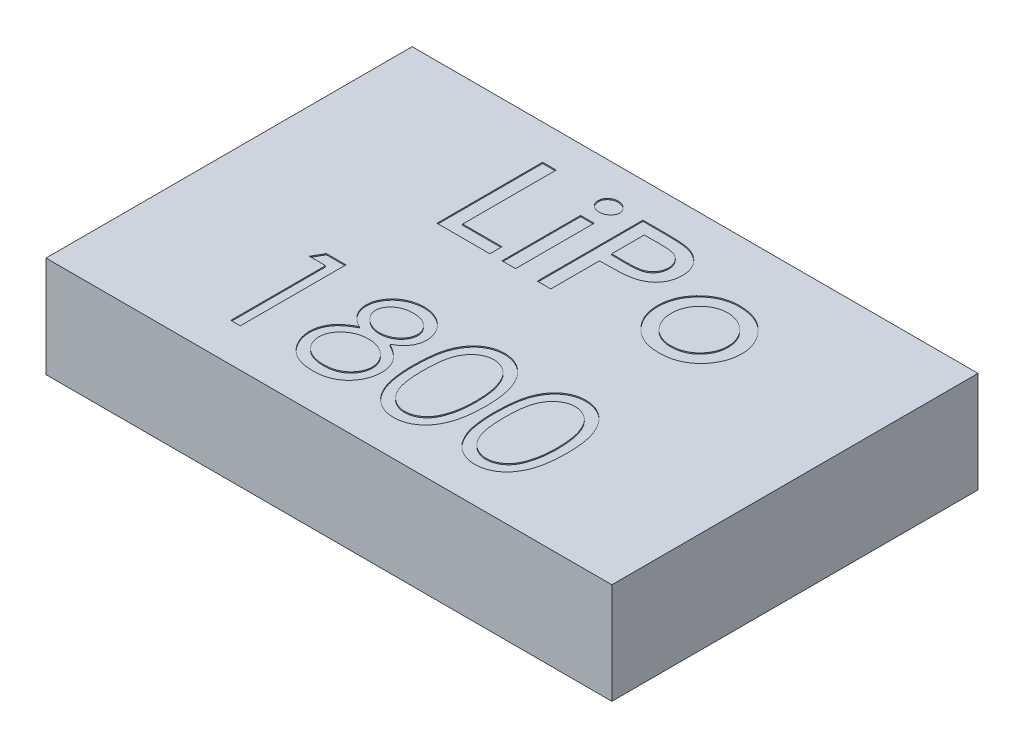
from build123d import *

# Parameters (mm, degrees)
SKETCH1_W           = 51
SKETCH1_H           = 33
BOSS_EXTRUDE1_DEPTH = 9.1
SKETCH2_W           = 1.221153846
SKETCH2_H           = 7.082692307
CUT_EXTRUDE1_DEPTH  = 0.1


with BuildPart() as part:
    # Sketch1 → Boss-Extrude1 (new body)
    with BuildSketch(Plane(origin=(0, 0, 0), x_dir=(1, 0, 0), z_dir=(0, 1, 0))):
        Rectangle(SKETCH1_W, SKETCH1_H)
    extrude(amount=BOSS_EXTRUDE1_DEPTH)

    # Sketch2 → Cut-Extrude1 (cut)
    # profile 1 of 9: a face of its own
    with BuildSketch(Plane(origin=(0, 9.1, 0), x_dir=(1, 0, 0), z_dir=(0, 1, 0))):
        Polygon((-10.598350213, 13.361806238), (-9.377196366, 13.361806238), (-9.377196366, 4.935844699), (-5.835850213, 4.935844699), (-5.835850213, 3.836806238), (-10.598350213, 3.836806238), align=None)
    # profile 2 of 9: a face of its own
    with BuildSketch(Plane(origin=(0, 9.1, 0), x_dir=(1, 0, 0), z_dir=(0, 1, 0))):
        with BuildLine():
            add(Edge.make_bspline(
                [(-4.191108626, 13.728152391), (-4.117679851, 13.724936738), (-3.976010868, 13.718732654), (-3.774094218, 13.66883684), (-3.593608765, 13.583028953), (-3.439854764, 13.464806694), (-3.312430853, 13.329393442), (-3.218088844, 13.183124591), (-3.161358797, 13.028050952), (-3.153307957, 12.922113108), (-3.149311751, 12.869528593)],
                knots=[0, 0, 0, 0, 1.180073081, 2.27676073, 3.320042968, 4.371717959, 5.377874923, 6.297457691, 7.154906711, 8, 8, 8, 8], degree=3))
            add(Edge.make_bspline(
                [(-3.149311751, 12.869528593), (-3.153315742, 12.817580851), (-3.161385463, 12.712884367), (-3.218078584, 12.559593325), (-3.313147329, 12.415284565), (-3.439179305, 12.279755579), (-3.594298376, 12.163936181), (-3.773997961, 12.07772869), (-3.976037617, 12.027991166), (-4.117688982, 12.021764411), (-4.191108626, 12.018537007)],
                knots=[0, 0, 0, 0, 0.838561902, 1.690053866, 2.604955955, 3.615478493, 4.665551833, 5.713360726, 6.814806749, 8, 8, 8, 8], degree=3))
            add(Edge.make_bspline(
                [(-4.191108626, 12.018537007), (-4.251925389, 12.021005876), (-4.370486997, 12.025818909), (-4.539982929, 12.077350709), (-4.697879131, 12.153451605), (-4.837234525, 12.262703327), (-4.954854465, 12.391748931), (-5.042220572, 12.538620751), (-5.093137316, 12.70024352), (-5.099786593, 12.812574569), (-5.103157905, 12.869528593)],
                knots=[0, 0, 0, 0, 1.050897616, 2.04871332, 3.044517726, 4.074156936, 5.096691018, 6.055190702, 7.01394389, 8, 8, 8, 8], degree=3))
            add(Edge.make_bspline(
                [(-5.103157905, 12.869528593), (-5.099927283, 12.927785626), (-5.093623853, 13.041453883), (-5.041722256, 13.204602794), (-4.955499043, 13.352748346), (-4.837236543, 13.482202432), (-4.697366444, 13.590885636), (-4.540011108, 13.670210698), (-4.369678147, 13.720298104), (-4.251238919, 13.725507592), (-4.191108626, 13.728152391)],
                knots=[0, 0, 0, 0, 1.003476519, 1.957934027, 2.921620235, 3.939572868, 4.964598795, 5.960849032, 6.964745478, 8, 8, 8, 8], degree=3))
        make_face()
    # profile 3 of 9: a face of its own
    with BuildSketch(Plane(origin=(0, 9.1, 0), x_dir=(1, 0, 0), z_dir=(0, 1, 0))):
        with Locations((-4.126234828, 7.378152392)):
            Rectangle(SKETCH2_W, SKETCH2_H)
    # profile 4 of 9: a face of its own
    with BuildSketch(Plane(origin=(0, 9.1, 0), x_dir=(1, 0, 0), z_dir=(0, 1, 0))):
        with BuildLine():
            Line((-1.561811751, 13.361806238), (0.39012635, 13.361806238))
            add(Edge.make_bspline(
                [(0.39012635, 13.361806238), (0.519245437, 13.361735896), (0.766696602, 13.361601089), (1.121568036, 13.352466126), (1.443516336, 13.344581896), (1.7330172, 13.329427732), (1.989411503, 13.308669432), (2.212791287, 13.284260159), (2.403396397, 13.256806468), (2.518346216, 13.231986144), (2.571030797, 13.220610324)],
                knots=[0, 0, 0, 0, 1.415450773, 2.712650385, 3.891531898, 4.945867971, 5.890285756, 6.71109784, 7.409261617, 8, 8, 8, 8], degree=3))
            add(Edge.make_bspline(
                [(2.571030797, 13.220610324), (2.645196833, 13.201538109), (2.79150369, 13.163914474), (3.000654784, 13.086361035), (3.199110919, 12.998237538), (3.386194529, 12.897994081), (3.559994629, 12.782218262), (3.724260868, 12.656429647), (3.873940665, 12.514266027), (4.014161925, 12.362624074), (4.137192867, 12.198040163), (4.247428946, 12.026083319), (4.33879789, 11.844255917), (4.413887702, 11.653234293), (4.472588124, 11.454014393), (4.514812185, 11.245961473), (4.540184167, 11.029531762), (4.54268417, 10.882042909), (4.54395748, 10.806923425)],
                knots=[0, 0, 0, 0, 1.085641105, 2.141637125, 3.15936318, 4.164535163, 5.147931294, 6.118832473, 7.09541784, 8.072503165, 9.045079613, 10.006206652, 10.966486436, 11.926469503, 12.914201526, 13.908586125, 14.934794539, 16, 16, 16, 16], degree=3))
            add(Edge.make_bspline(
                [(4.54395748, 10.806923425), (4.542656234, 10.731807441), (4.540090433, 10.583693382), (4.51487867, 10.365969824), (4.472616345, 10.1574847), (4.415638852, 9.95731699), (4.340757786, 9.766711569), (4.251281111, 9.58405928), (4.14312097, 9.41142953), (4.019643415, 9.247624084), (3.88020202, 9.095160283), (3.726817677, 8.954616816), (3.557474197, 8.82844822), (3.373908393, 8.714389899), (3.176759905, 8.610441779), (2.964045399, 8.521034987), (2.7367139, 8.444851885), (2.578940711, 8.404343242), (2.498524787, 8.383696262)],
                knots=[0, 0, 0, 0, 1.042501879, 2.055610221, 3.037454288, 3.993184118, 4.940927036, 5.876790881, 6.812738028, 7.76458517, 8.720845088, 9.677105007, 10.648370915, 11.647960469, 12.67482723, 13.739162042, 14.847666245, 16, 16, 16, 16], degree=3))
            add(Edge.make_bspline(
                [(2.498524787, 8.383696262), (2.439505759, 8.370900511), (2.310756969, 8.342986846), (2.097106095, 8.313940679), (1.848159215, 8.290144344), (1.563129515, 8.269441091), (1.243185328, 8.252050173), (0.886907518, 8.241697777), (0.49510865, 8.233344161), (0.221587158, 8.233091626), (0.07911373, 8.232960084)],
                knots=[0, 0, 0, 0, 0.596754895, 1.30180848, 2.129432098, 3.068723067, 4.126429569, 5.296393252, 6.591729958, 8, 8, 8, 8], degree=3))
            Line((0.07911373, 8.232960084), (-0.340657905, 8.232960084))
            Line((-0.340657905, 8.232960084), (-0.340657905, 3.836806238))
            Line((-0.340657905, 3.836806238), (-1.561811751, 3.836806238))
            Line((-1.561811751, 3.836806238), (-1.561811751, 13.361806238))
        make_face()
        with BuildLine():
            Line((-0.340657905, 12.262767776), (-0.340657905, 9.328182439))
            Line((-0.340657905, 9.328182439), (1.033140172, 9.312918016))
            add(Edge.make_bspline(
                [(1.033140172, 9.312918016), (1.110737224, 9.313941236), (1.260242308, 9.315912659), (1.475989828, 9.32275767), (1.674431727, 9.336669694), (1.855951328, 9.352895027), (2.020915325, 9.37564302), (2.168581062, 9.404033617), (2.300207641, 9.43593199), (2.450724508, 9.486083293), (2.619204629, 9.564390582), (2.798317402, 9.683871308), (2.956199136, 9.826761452), (3.086585638, 9.994942872), (3.191515296, 10.180245704), (3.269512158, 10.378300221), (3.313659786, 10.588739575), (3.319729862, 10.732312671), (3.322803634, 10.805015372)],
                knots=[0, 0, 0, 0, 1.196816259, 2.305888068, 3.328295896, 4.264290022, 5.116006351, 5.89509982, 6.582615619, 7.202969204, 8.339503699, 9.435837163, 10.511976311, 11.608836183, 12.702577786, 13.786378287, 14.879063815, 16, 16, 16, 16], degree=3))
            add(Edge.make_bspline(
                [(3.322803634, 10.805015372), (3.319707658, 10.875180935), (3.313566908, 11.014351692), (3.269188509, 11.219036461), (3.19115565, 11.413186301), (3.086055084, 11.595886121), (2.958338151, 11.762876496), (2.807051368, 11.906529507), (2.635836608, 12.023934033), (2.475994457, 12.099129558), (2.333470587, 12.148065413), (2.207856286, 12.176811812), (2.065950506, 12.203689297), (1.906872052, 12.226730861), (1.730472926, 12.243348817), (1.536965772, 12.254008336), (1.327052093, 12.262361741), (1.181341855, 12.262628958), (1.105646182, 12.262767776)],
                knots=[0, 0, 0, 0, 1.113934591, 2.209447376, 3.306634974, 4.424089692, 5.547326231, 6.633252657, 7.723023745, 8.829884498, 9.427152571, 10.113060991, 10.873719268, 11.720735618, 12.664423995, 13.686322671, 14.798057257, 16, 16, 16, 16], degree=3))
            Line((1.105646182, 12.262767776), (-0.340657905, 12.262767776))
        make_face(mode=Mode.SUBTRACT)
    # profile 5 of 9: a face of its own
    with BuildSketch(Plane(origin=(0, 9.1, 0), x_dir=(1, 0, 0), z_dir=(0, 1, 0))):
        with BuildLine():
            add(Edge.make_bspline(
                [(9.493446662, 11.04161393), (9.634797507, 11.037743055), (9.911535782, 11.030164612), (10.316476842, 10.97684668), (10.701009508, 10.884208572), (11.066235877, 10.757416424), (11.410652857, 10.591301023), (11.735120689, 10.390330074), (12.038479309, 10.150595784), (12.221211194, 9.966773961), (12.313548826, 9.873885564)],
                knots=[0, 0, 0, 0, 1.078775739, 2.112039281, 3.110494877, 4.093081892, 5.057110616, 6.022958758, 7.000966324, 8, 8, 8, 8], degree=3))
            add(Edge.make_bspline(
                [(12.313548826, 9.873885564), (12.395433514, 9.781816715), (12.556425196, 9.600802178), (12.764443884, 9.308817138), (12.941597314, 9.008455168), (13.084919194, 8.697451839), (13.199157087, 8.377229304), (13.278381894, 8.046522259), (13.32827169, 7.705956336), (13.333579083, 7.47563716), (13.336265172, 7.359071863)],
                knots=[0, 0, 0, 0, 1.062178036, 2.088324843, 3.086640365, 4.066023852, 5.037709567, 6.014384934, 6.995073642, 8, 8, 8, 8], degree=3))
            add(Edge.make_bspline(
                [(13.336265172, 7.359071863), (13.332907951, 7.241863368), (13.326254405, 7.009572423), (13.274752139, 6.666429179), (13.193300368, 6.332425919), (13.076129763, 6.009087469), (12.925333935, 5.696062999), (12.744424903, 5.3914484), (12.526306673, 5.099298018), (12.281065406, 4.818764785), (12.008532914, 4.55996085), (11.711109613, 4.333380476), (11.392441672, 4.141633173), (11.053104502, 3.983798683), (10.691479758, 3.864533619), (10.311070578, 3.776210386), (9.908942116, 3.724049815), (9.634160429, 3.717860406), (9.493446662, 3.714690853)],
                knots=[0, 0, 0, 0, 0.952871876, 1.888459614, 2.815544184, 3.744891397, 4.679563604, 5.637601804, 6.621431805, 7.640342292, 8.664856555, 9.672479278, 10.67487095, 11.683873433, 12.709444777, 13.765907845, 14.855937143, 16, 16, 16, 16], degree=3))
            add(Edge.make_bspline(
                [(9.493446662, 3.714690853), (9.359058764, 3.717777476), (9.095619574, 3.723828152), (8.710654345, 3.777544922), (8.343561654, 3.859522773), (7.997018598, 3.981481826), (7.668170377, 4.133994019), (7.359216832, 4.32315507), (7.06777828, 4.544464688), (6.801457187, 4.80052102), (6.558713232, 5.075790763), (6.348015361, 5.368026121), (6.166795338, 5.6704329), (6.019466069, 5.98556902), (5.906565533, 6.313321178), (5.823900594, 6.650984624), (5.775627673, 7.001512845), (5.768651105, 7.238718301), (5.765111326, 7.359071863)],
                knots=[0, 0, 0, 0, 1.108842573, 2.173652473, 3.202745058, 4.208988794, 5.200203338, 6.189803525, 7.193715926, 8.215010613, 9.234454675, 10.219573757, 11.184848795, 12.140854958, 13.08565054, 14.042002664, 15.006549187, 16, 16, 16, 16], degree=3))
            add(Edge.make_bspline(
                [(5.765111326, 7.359071863), (5.767994306, 7.478146832), (5.773674347, 7.712748084), (5.820235544, 8.058661691), (5.899235474, 8.391034012), (6.005732999, 8.712554901), (6.146362351, 9.020776242), (6.317331431, 9.317437239), (6.517094145, 9.603633224), (6.672812043, 9.779305694), (6.751574667, 9.868161406)],
                knots=[0, 0, 0, 0, 1.034079547, 2.037341334, 3.024980457, 3.998111168, 4.974764182, 5.962233312, 6.969290918, 8, 8, 8, 8], degree=3))
            add(Edge.make_bspline(
                [(6.751574667, 9.868161406), (6.843202521, 9.961761466), (7.023841567, 10.146288603), (7.324513075, 10.385527727), (7.641737127, 10.589511032), (7.978705207, 10.753535503), (8.331484681, 10.885324778), (8.703541735, 10.976153389), (9.093073482, 11.030149181), (9.358438108, 11.037747939), (9.493446662, 11.04161393)],
                knots=[0, 0, 0, 0, 1.021997278, 2.014808882, 2.992991082, 3.961403697, 4.935644248, 5.92819495, 6.945935601, 8, 8, 8, 8], degree=3))
        make_face()
        with BuildLine():
            add(Edge.make_bspline(
                [(9.489630557, 9.942575468), (9.408098359, 9.940402881), (9.246211829, 9.936089092), (9.007766223, 9.900789691), (8.776007663, 9.843707313), (8.553479313, 9.760833402), (8.336822312, 9.657266025), (8.129677823, 9.528268596), (7.92737738, 9.37907638), (7.737285687, 9.206315811), (7.560424337, 9.018240689), (7.407188279, 8.814279481), (7.276099116, 8.600150812), (7.171115867, 8.37315184), (7.088166809, 8.134823522), (7.030126114, 7.884707928), (6.991871204, 7.622922761), (6.988159459, 7.444437558), (6.986265172, 7.353347704)],
                knots=[0, 0, 0, 0, 0.976916649, 1.939720157, 2.882730922, 3.833047911, 4.780976627, 5.756404754, 6.753607, 7.790049989, 8.831165002, 9.84360893, 10.842529111, 11.835057585, 12.835634664, 13.861933882, 14.908838789, 16, 16, 16, 16], degree=3))
            add(Edge.make_bspline(
                [(6.986265172, 7.353347704), (6.99060238, 7.234712084), (6.999138119, 7.001234034), (7.068887458, 6.659248005), (7.179583389, 6.332411757), (7.334137852, 6.024989988), (7.52307591, 5.743734873), (7.743312719, 5.497511376), (7.986427352, 5.284359533), (8.257113456, 5.113190511), (8.546090253, 4.979218218), (8.849446649, 4.883842361), (9.165472058, 4.824234279), (9.380607991, 4.817262395), (9.489630557, 4.813729314)],
                knots=[0, 0, 0, 0, 1.073737222, 2.11314337, 3.147909503, 4.191315005, 5.220292011, 6.207728104, 7.175628903, 8.139268678, 9.098074859, 10.052770626, 11.013219503, 12, 12, 12, 12], degree=3))
            add(Edge.make_bspline(
                [(9.489630557, 4.813729314), (9.607567216, 4.817758922), (9.839967639, 4.825699477), (10.180349988, 4.888810014), (10.505414382, 4.990141242), (10.812883057, 5.131367396), (11.09823007, 5.31028162), (11.353390208, 5.527421816), (11.577016114, 5.779188156), (11.768496277, 6.059820683), (11.923124709, 6.364308423), (12.034139571, 6.683867482), (12.101476081, 7.015366692), (12.110531531, 7.239826927), (12.115111326, 7.353347704)],
                knots=[0, 0, 0, 0, 1.042880454, 2.055051067, 3.051726387, 4.048830532, 5.040201766, 6.022282375, 7.002717173, 8.011000956, 9.020163719, 10.014978664, 10.996075346, 12, 12, 12, 12], degree=3))
            add(Edge.make_bspline(
                [(12.115111326, 7.353347704), (12.113121352, 7.441247624), (12.109195862, 7.61464199), (12.071729085, 7.869753038), (12.010921224, 8.115403897), (11.924512047, 8.350497427), (11.815087986, 8.575851443), (11.680455161, 8.790505247), (11.521090556, 8.995482022), (11.339418377, 9.187464272), (11.142484276, 9.363983384), (10.934397813, 9.519870242), (10.715586026, 9.649339783), (10.489081681, 9.758445021), (10.251689712, 9.839519865), (10.005849796, 9.898916446), (9.750934048, 9.93673783), (9.577533574, 9.940611675), (9.489630557, 9.942575468)],
                knots=[0, 0, 0, 0, 1.02928639, 2.030405262, 3.013559112, 3.98951401, 4.959304921, 5.943474834, 6.952548865, 7.996299005, 9.035918103, 10.047849461, 11.03697177, 12.01024899, 12.98822153, 13.969594738, 14.97071361, 16, 16, 16, 16], degree=3))
        make_face(mode=Mode.SUBTRACT)
    # profile 6 of 9: a face of its own
    with BuildSketch(Plane(origin=(0, 9.1, 0), x_dir=(1, 0, 0), z_dir=(0, 1, 0))):
        Polygon((-13.214290717, -3.513193762), (-11.453157905, -3.513193762), (-11.453157905, -13.038193762), (-12.307965597, -13.038193762), (-12.307965597, -4.490116839), (-13.773350213, -4.490116839), align=None)
    # profile 7 of 9: a face of its own
    with BuildSketch(Plane(origin=(0, 9.1, 0), x_dir=(1, 0, 0), z_dir=(0, 1, 0))):
        with BuildLine():
            add(Edge.make_bspline(
                [(-3.2809674, -7.73189869), (-3.203002425, -7.772551271), (-3.050944687, -7.851837378), (-2.834380999, -7.979501845), (-2.636465103, -8.1140519), (-2.451705788, -8.249132346), (-2.283349098, -8.38991634), (-2.133277517, -8.536963715), (-1.997784065, -8.686604037), (-1.879601175, -8.841371245), (-1.775651212, -9.000854169), (-1.685811044, -9.165471405), (-1.609019942, -9.334862192), (-1.548160802, -9.510875565), (-1.498027211, -9.690925991), (-1.463531458, -9.877338356), (-1.444979703, -10.068884312), (-1.441472289, -10.198338047), (-1.439696366, -10.263884868)],
                knots=[0, 0, 0, 0, 1.272397273, 2.481599622, 3.635517121, 4.734568067, 5.792894095, 6.808321871, 7.773003508, 8.711915296, 9.623354172, 10.525449501, 11.423591555, 12.311487226, 13.218079475, 14.126165749, 15.051214107, 16, 16, 16, 16], degree=3))
            add(Edge.make_bspline(
                [(-1.439696366, -10.263884868), (-1.441795732, -10.355590841), (-1.445951165, -10.537111369), (-1.482146122, -10.80502543), (-1.53633787, -11.065226065), (-1.615475686, -11.317656229), (-1.718109985, -11.560923024), (-1.844593375, -11.795234686), (-1.987771011, -12.02443152), (-2.102757462, -12.16545432), (-2.160940357, -12.236811551)],
                knots=[0, 0, 0, 0, 1.025265484, 2.029385089, 3.018602448, 3.995076438, 4.983346944, 5.966715145, 6.97116228, 8, 8, 8, 8], degree=3))
            add(Edge.make_bspline(
                [(-2.160940357, -12.236811551), (-2.236695333, -12.320070322), (-2.387269161, -12.485559013), (-2.645214128, -12.700418003), (-2.928302255, -12.88098314), (-3.235438146, -13.028135938), (-3.565800801, -13.142669597), (-3.919319827, -13.22497245), (-4.296684415, -13.272114203), (-4.556051447, -13.278928633), (-4.689110429, -13.282424532)],
                knots=[0, 0, 0, 0, 0.954267603, 1.896743057, 2.838368354, 3.796610408, 4.779680527, 5.799409237, 6.871065594, 8, 8, 8, 8], degree=3))
            add(Edge.make_bspline(
                [(-4.689110429, -13.282424532), (-4.817054008, -13.279288145), (-5.066019217, -13.273185056), (-5.42839887, -13.231834496), (-5.766190938, -13.159368658), (-6.081359495, -13.060187257), (-6.37200451, -12.931163707), (-6.637297807, -12.770576538), (-6.881066974, -12.584889542), (-7.095914163, -12.3687698), (-7.286654857, -12.137290876), (-7.454207916, -11.898481138), (-7.593474515, -11.652318787), (-7.71138611, -11.402474316), (-7.801650515, -11.145445854), (-7.864167744, -10.882555818), (-7.90387152, -10.614263394), (-7.90915418, -10.433202251), (-7.911811751, -10.342115037)],
                knots=[0, 0, 0, 0, 1.256902934, 2.445805442, 3.576955095, 4.645999104, 5.686449165, 6.692658513, 7.68621702, 8.689161843, 9.678783111, 10.630372946, 11.551080876, 12.453998257, 13.34127905, 14.221779781, 15.105423033, 16, 16, 16, 16], degree=3))
            add(Edge.make_bspline(
                [(-7.911811751, -10.342115037), (-7.910239089, -10.27527895), (-7.907130954, -10.143187251), (-7.885618474, -9.948035437), (-7.851033304, -9.758090241), (-7.804062926, -9.572650075), (-7.740405918, -9.393064983), (-7.66354697, -9.218484051), (-7.573925013, -9.048710182), (-7.470289843, -8.882814941), (-7.349725049, -8.72312284), (-7.213208259, -8.56692374), (-7.058010988, -8.416641373), (-6.885859788, -8.270439631), (-6.698722005, -8.125725017), (-6.491736869, -7.990318355), (-6.270391469, -7.854633465), (-6.113078186, -7.773512237), (-6.03237966, -7.73189869)],
                knots=[0, 0, 0, 0, 0.941657376, 1.861047343, 2.762797495, 3.66048619, 4.553285746, 5.444104102, 6.34607688, 7.256116206, 8.197091036, 9.162375105, 10.176350973, 11.237807142, 12.343728897, 13.50695164, 14.721116704, 16, 16, 16, 16], degree=3))
            add(Edge.make_bspline(
                [(-6.03237966, -7.73189869), (-6.142846186, -7.671660499), (-6.356740302, -7.555022499), (-6.639957852, -7.340718691), (-6.883228049, -7.108613995), (-7.079864102, -6.853807196), (-7.234637808, -6.584258202), (-7.340824154, -6.301653487), (-7.412660299, -6.011233207), (-7.419776365, -5.8128242), (-7.423350213, -5.713178738)],
                knots=[0, 0, 0, 0, 1.166880483, 2.259407225, 3.286803203, 4.280235371, 5.237608625, 6.161067461, 7.076446754, 8, 8, 8, 8], degree=3))
            add(Edge.make_bspline(
                [(-7.423350213, -5.713178738), (-7.418899523, -5.611676097), (-7.40995286, -5.407638087), (-7.337608252, -5.103909995), (-7.219715785, -4.805596343), (-7.0593665, -4.51414301), (-6.859648433, -4.239414211), (-6.620036048, -3.993013493), (-6.346251362, -3.777172959), (-6.039661024, -3.59599066), (-5.709725268, -3.448533703), (-5.361611762, -3.346810995), (-5.001385806, -3.280309849), (-4.756191298, -3.272780596), (-4.631868842, -3.268962993)],
                knots=[0, 0, 0, 0, 0.888701115, 1.786444228, 2.72001202, 3.692817113, 4.693886446, 5.687152267, 6.695133018, 7.739871481, 8.800368666, 9.853104506, 10.91144658, 12, 12, 12, 12], degree=3))
            add(Edge.make_bspline(
                [(-4.631868842, -3.268962993), (-4.510754889, -3.272899113), (-4.27193197, -3.280660692), (-3.920882305, -3.345394981), (-3.584990317, -3.453516032), (-3.265414323, -3.600193475), (-2.967875455, -3.780860793), (-2.704979171, -3.999666028), (-2.472752644, -4.24497982), (-2.280662257, -4.519625312), (-2.122376108, -4.809958725), (-2.012155799, -5.113731442), (-1.941529355, -5.424379952), (-1.932621128, -5.634577663), (-1.928157905, -5.739891479)],
                knots=[0, 0, 0, 0, 1.072916533, 2.115669174, 3.151510826, 4.193348718, 5.225979165, 6.227137561, 7.216255879, 8.211077061, 9.189680878, 10.138522389, 11.067357538, 12, 12, 12, 12], degree=3))
            add(Edge.make_bspline(
                [(-1.928157905, -5.739891479), (-1.932061959, -5.843242257), (-1.9397293, -6.046217311), (-2.004226992, -6.34210877), (-2.112848224, -6.619210176), (-2.261150197, -6.880665853), (-2.454440988, -7.121734072), (-2.690140468, -7.345480322), (-2.966369491, -7.553742619), (-3.173908046, -7.671271225), (-3.2809674, -7.73189869)],
                knots=[0, 0, 0, 0, 0.975232327, 1.915300861, 2.843280834, 3.77672583, 4.742871857, 5.749627742, 6.839139064, 8, 8, 8, 8], degree=3))
        make_face()
        with BuildLine():
            add(Edge.make_bspline(
                [(-4.679570164, -4.24588607), (-4.746383429, -4.247658919), (-4.877099389, -4.251127387), (-5.068765986, -4.269248392), (-5.2510265, -4.304499646), (-5.425785215, -4.351413568), (-5.590646125, -4.414790164), (-5.747848235, -4.489343725), (-5.894716087, -4.579983804), (-6.033022633, -4.681659635), (-6.157530098, -4.793491044), (-6.268032485, -4.910005521), (-6.359821138, -5.03349141), (-6.437765872, -5.160877017), (-6.494321287, -5.295943085), (-6.536678429, -5.434548644), (-6.565311644, -5.578445225), (-6.567457191, -5.676788157), (-6.56854252, -5.726535109)],
                knots=[0, 0, 0, 0, 1.203892937, 2.355340988, 3.463153438, 4.544400666, 5.610487187, 6.640501085, 7.674077295, 8.714426146, 9.728707835, 10.68524104, 11.601827946, 12.495867327, 13.368432065, 14.231010473, 15.105153427, 16, 16, 16, 16], degree=3))
            add(Edge.make_bspline(
                [(-6.56854252, -5.726535109), (-6.5666719, -5.77628421), (-6.562975287, -5.87459558), (-6.534386331, -6.019772544), (-6.491777319, -6.162434284), (-6.424692305, -6.299188549), (-6.344229572, -6.434779262), (-6.244920627, -6.565817642), (-6.126568344, -6.692759726), (-5.993143667, -6.814525805), (-5.847787982, -6.928550296), (-5.69379855, -7.027537311), (-5.533108013, -7.110361569), (-5.367367382, -7.179293735), (-5.194887465, -7.232878493), (-5.016725133, -7.270893166), (-4.832850445, -7.294520601), (-4.708261864, -7.29734278), (-4.645225213, -7.298770686)],
                knots=[0, 0, 0, 0, 0.873023192, 1.725219244, 2.590779336, 3.480155217, 4.391973325, 5.357036234, 6.360879153, 7.436073238, 8.526419356, 9.601555421, 10.645666583, 11.697338044, 12.750135903, 13.812665442, 14.89329948, 16, 16, 16, 16], degree=3))
            add(Edge.make_bspline(
                [(-4.645225213, -7.298770686), (-4.56426243, -7.29639524), (-4.40313653, -7.291667811), (-4.165612063, -7.247713545), (-3.934664438, -7.178573155), (-3.712762134, -7.083976389), (-3.505648941, -6.965246285), (-3.321027041, -6.823097857), (-3.160471211, -6.660813364), (-3.025649979, -6.480919218), (-2.921120326, -6.289462396), (-2.839744691, -6.097328742), (-2.792225241, -5.902468385), (-2.786027005, -5.771929719), (-2.782965597, -5.70745458)],
                knots=[0, 0, 0, 0, 1.076279235, 2.141928126, 3.20205304, 4.278698113, 5.344010996, 6.36967002, 7.368914609, 8.37248503, 9.349703398, 10.264243087, 11.142681841, 12, 12, 12, 12], degree=3))
            add(Edge.make_bspline(
                [(-2.782965597, -5.70745458), (-2.784413118, -5.662202568), (-2.787286241, -5.57238381), (-2.810962822, -5.43974583), (-2.850085624, -5.310125321), (-2.903053006, -5.182451484), (-2.972748234, -5.058515634), (-3.055382201, -4.936369516), (-3.155760737, -4.818760902), (-3.268418173, -4.702949016), (-3.39617675, -4.595768209), (-3.538790254, -4.501512319), (-3.695527532, -4.421468692), (-3.866392289, -4.356457152), (-4.050755261, -4.307628329), (-4.247767297, -4.271062268), (-4.459071114, -4.250452586), (-4.604476365, -4.247441256), (-4.679570164, -4.24588607)],
                knots=[0, 0, 0, 0, 0.814439003, 1.616544685, 2.417341072, 3.248991801, 4.09997495, 4.973547432, 5.9003056, 6.880240646, 7.880314356, 8.896779544, 9.951930927, 11.043077905, 12.18215768, 13.381699519, 14.647792085, 16, 16, 16, 16], degree=3))
        make_face(mode=Mode.SUBTRACT)
        with BuildLine():
            add(Edge.make_bspline(
                [(-4.624236631, -8.275693762), (-4.708943233, -8.277200458), (-4.875116918, -8.280156227), (-5.118567558, -8.313056939), (-5.352210815, -8.35885693), (-5.575258928, -8.428337283), (-5.787617706, -8.51867916), (-5.990436749, -8.627358158), (-6.182164466, -8.7558244), (-6.360153314, -8.902445761), (-6.522686089, -9.060450418), (-6.66528432, -9.227715228), (-6.786381144, -9.40113155), (-6.883898776, -9.582901831), (-6.963940704, -9.769177115), (-7.016502042, -9.964596356), (-7.050197985, -10.165402714), (-7.054722718, -10.301909839), (-7.057004059, -10.37073583)],
                knots=[0, 0, 0, 0, 1.140299081, 2.23698856, 3.303958914, 4.344563908, 5.37730929, 6.408454204, 7.439741482, 8.480804886, 9.510774543, 10.48932336, 11.43758569, 12.353841022, 13.263987381, 14.161954604, 15.073269652, 16, 16, 16, 16], degree=3))
            add(Edge.make_bspline(
                [(-7.057004059, -10.37073583), (-7.053294047, -10.456272796), (-7.045933471, -10.625976138), (-6.987540762, -10.876791353), (-6.893826911, -11.119600081), (-6.763129716, -11.352423609), (-6.601292965, -11.570002113), (-6.402284506, -11.759655138), (-6.178471941, -11.928170019), (-5.922282495, -12.064460613), (-5.64244217, -12.173303755), (-5.339025393, -12.248295339), (-5.01638665, -12.297938142), (-4.793611617, -12.302940621), (-4.679570164, -12.305501455)],
                knots=[0, 0, 0, 0, 0.898778495, 1.783155532, 2.693654817, 3.627872908, 4.583023416, 5.533784346, 6.509005473, 7.520592997, 8.575161974, 9.658835044, 10.801527049, 12, 12, 12, 12], degree=3))
            add(Edge.make_bspline(
                [(-4.679570164, -12.305501455), (-4.590442377, -12.303790198), (-4.416792867, -12.30045612), (-4.163466106, -12.27102579), (-3.924403442, -12.224354312), (-3.700068469, -12.156472233), (-3.487949877, -12.073604797), (-3.291644106, -11.967000775), (-3.106101114, -11.845754811), (-2.940463752, -11.701905113), (-2.789606234, -11.548200202), (-2.65807063, -11.385485871), (-2.543886152, -11.218184329), (-2.454266908, -11.042514795), (-2.382621889, -10.861847549), (-2.331122786, -10.674516622), (-2.299346801, -10.479947452), (-2.296133077, -10.347960695), (-2.294504059, -10.281057344)],
                knots=[0, 0, 0, 0, 1.224942928, 2.386581632, 3.501229538, 4.569074225, 5.605009692, 6.626002462, 7.634866581, 8.645888296, 9.63523824, 10.59253846, 11.518950513, 12.414518923, 13.29783783, 14.186679152, 15.080837789, 16, 16, 16, 16], degree=3))
            add(Edge.make_bspline(
                [(-2.294504059, -10.281057344), (-2.296969261, -10.216076867), (-2.301830209, -10.087946718), (-2.332682204, -9.898082099), (-2.386881842, -9.714650155), (-2.4612514, -9.535444067), (-2.560259591, -9.364094894), (-2.676858845, -9.196138742), (-2.817540696, -9.036237275), (-2.976506404, -8.883148492), (-3.149749719, -8.74159138), (-3.33390102, -8.616366372), (-3.527542806, -8.510905256), (-3.730265316, -8.425135365), (-3.941618414, -8.357678037), (-4.161446648, -8.310553793), (-4.39000739, -8.280891302), (-4.545278146, -8.277445849), (-4.624236631, -8.275693762)],
                knots=[0, 0, 0, 0, 0.917430815, 1.809013306, 2.70690318, 3.612392954, 4.541220862, 5.495268465, 6.494511384, 7.542276156, 8.608045339, 9.649016899, 10.681629292, 11.715607085, 12.752076957, 13.808767841, 14.885711793, 16, 16, 16, 16], degree=3))
        make_face(mode=Mode.SUBTRACT)
    # profile 8 of 9: a face of its own
    with BuildSketch(Plane(origin=(0, 9.1, 0), x_dir=(1, 0, 0), z_dir=(0, 1, 0))):
        with BuildLine():
            add(Edge.make_bspline(
                [(-0.584888674, -8.279509868), (-0.583995996, -8.126844834), (-0.582261956, -7.830290806), (-0.562971325, -7.398169744), (-0.530925572, -6.992784958), (-0.487008864, -6.614117042), (-0.433565504, -6.26206824), (-0.36222193, -5.937579366), (-0.281088517, -5.639148579), (-0.187056504, -5.365802719), (-0.080954021, -5.113859112), (0.034527789, -4.8786591), (0.163971979, -4.660558556), (0.299980578, -4.456076426), (0.448059145, -4.268559943), (0.60399371, -4.095360982), (0.773870388, -3.94048244), (0.951914432, -3.799386431), (1.13973781, -3.675698941), (1.33198678, -3.566752702), (1.529984603, -3.473680206), (1.734271858, -3.400499806), (1.943012391, -3.340054573), (2.156935908, -3.298718937), (2.37639562, -3.272710493), (2.524526882, -3.270224011), (2.59965159, -3.268962993)],
                knots=[0, 0, 0, 0, 1.646270934, 3.197905019, 4.663502075, 6.030701355, 7.308322542, 8.50163776, 9.611534131, 10.641858119, 11.616356847, 12.558055219, 13.465016945, 14.349605745, 15.204443733, 16.039544428, 16.859896111, 17.680448484, 18.487036065, 19.28249412, 20.06191084, 20.843045899, 21.620316918, 22.403196591, 23.190181807, 24, 24, 24, 24], degree=3))
            add(Edge.make_bspline(
                [(2.59965159, -3.268962993), (2.675403857, -3.270290547), (2.826051281, -3.272930635), (3.048774016, -3.298305079), (3.266351365, -3.340408635), (3.477855728, -3.400065002), (3.685024441, -3.474076093), (3.886237093, -3.566841747), (4.082743508, -3.674824951), (4.271420934, -3.801708503), (4.454340708, -3.943174554), (4.627009807, -4.10309296), (4.789443948, -4.279848982), (4.943681744, -4.471551483), (5.085347333, -4.681877321), (5.220257888, -4.907168362), (5.341013214, -5.151364502), (5.45731258, -5.410391346), (5.55769788, -5.691416018), (5.64822959, -5.992854402), (5.721378783, -6.31826701), (5.782309589, -6.665946506), (5.829512484, -7.037169729), (5.863891317, -7.431140916), (5.882051642, -7.848119265), (5.885471664, -8.133210268), (5.887226711, -8.279509868)],
                knots=[0, 0, 0, 0, 0.810914788, 1.612654377, 2.396697861, 3.181598691, 3.963628158, 4.749916497, 5.551656086, 6.361998678, 7.18212741, 8.025565596, 8.878627764, 9.750805457, 10.657531673, 11.591944965, 12.560506719, 13.57287815, 14.630710178, 15.753379473, 16.941251878, 18.199788006, 19.531962791, 20.947069417, 22.433333509, 24, 24, 24, 24], degree=3))
            add(Edge.make_bspline(
                [(5.887226711, -8.279509868), (5.88545347, -8.425171361), (5.881998382, -8.708986838), (5.864094902, -9.124088992), (5.828828913, -9.515969382), (5.784714587, -9.885567854), (5.723615895, -10.231346089), (5.648490407, -10.554500623), (5.565077743, -10.85642699), (5.462113053, -11.134651727), (5.349416763, -11.393056059), (5.226802265, -11.634357369), (5.095439381, -11.860688495), (4.952322868, -12.070237806), (4.799777507, -12.264489723), (4.634538382, -12.440015396), (4.461263433, -12.601044153), (4.277805358, -12.744331796), (4.086185351, -12.8697483), (3.890353863, -12.98190885), (3.686836227, -13.072349256), (3.480244548, -13.150005332), (3.267623781, -13.209333705), (3.04923896, -13.250356126), (2.826200918, -13.279126656), (2.675429516, -13.281321433), (2.59965159, -13.282424532)],
                knots=[0, 0, 0, 0, 1.561518951, 3.042555995, 4.452378317, 5.7783523, 7.031515105, 8.214008947, 9.334062868, 10.386615937, 11.391082383, 12.354592575, 13.286541444, 14.194233754, 15.072674879, 15.931287219, 16.775624067, 17.606195743, 18.42308326, 19.229000347, 20.022332153, 20.807536673, 21.593273796, 22.3848459, 23.188221202, 24, 24, 24, 24], degree=3))
            add(Edge.make_bspline(
                [(2.59965159, -13.282424532), (2.524528966, -13.281155379), (2.376401813, -13.278652857), (2.156911999, -13.252761916), (1.94387192, -13.211136296), (1.736230311, -13.152852538), (1.532921866, -13.081510734), (1.336716972, -12.988563923), (1.145434061, -12.881519064), (0.95958347, -12.759611524), (0.782657517, -12.61994323), (0.613660598, -12.465463272), (0.456838225, -12.292316703), (0.310876865, -12.103237498), (0.172154525, -11.899965174), (0.044548445, -11.679724388), (-0.073482237, -11.443388426), (-0.181369165, -11.189430398), (-0.277023742, -10.914144487), (-0.361517862, -10.614381366), (-0.428231391, -10.287495242), (-0.485335005, -9.93611155), (-0.531393504, -9.558720353), (-0.562837775, -9.155116771), (-0.582272354, -8.72555231), (-0.584000653, -8.430903853), (-0.584888674, -8.279509868)],
                knots=[0, 0, 0, 0, 0.810891512, 1.598919785, 2.382837074, 3.152667961, 3.926044502, 4.706494248, 5.493654104, 6.291793342, 7.103789334, 7.925228297, 8.761435821, 9.622817696, 10.50288917, 11.416980706, 12.369136599, 13.353924996, 14.394355917, 15.514179734, 16.714354668, 17.994756427, 19.357759367, 20.818452758, 22.365282078, 24, 24, 24, 24], degree=3))
        make_face()
        with BuildLine():
            add(Edge.make_bspline(
                [(0.269919018, -8.275693762), (0.270244085, -8.402917007), (0.270874975, -8.649832343), (0.287356493, -9.008634361), (0.30980891, -9.343289327), (0.33876844, -9.654222165), (0.381775036, -9.940380414), (0.429962794, -10.203732194), (0.488604381, -10.442883818), (0.557987251, -10.65947636), (0.637015079, -10.857185611), (0.723300322, -11.041157489), (0.815994146, -11.213565259), (0.919732692, -11.372860293), (1.032712971, -11.519562068), (1.152383055, -11.656267133), (1.283209159, -11.778178918), (1.464194344, -11.924392717), (1.703126178, -12.075484073), (2.004171846, -12.207054503), (2.313512416, -12.289738189), (2.523474032, -12.300253124), (2.628272384, -12.305501455)],
                knots=[0, 0, 0, 0, 1.459021318, 2.831673884, 4.118529203, 5.306027144, 6.411944654, 7.436330062, 8.375795394, 9.233974572, 10.042671642, 10.816086306, 11.563610507, 12.285937304, 12.993564865, 13.685989202, 14.367179055, 15.041617293, 16.353048772, 17.594441528, 18.799311195, 20, 20, 20, 20], degree=3))
            add(Edge.make_bspline(
                [(2.628272384, -12.305501455), (2.733748619, -12.301153208), (2.94448332, -12.292465693), (3.252368862, -12.208649129), (3.551264097, -12.082185597), (3.785502735, -11.932649886), (3.963708799, -11.790242075), (4.091390037, -11.668826496), (4.208580326, -11.532875172), (4.319729115, -11.386192088), (4.421671314, -11.225974827), (4.51437171, -11.052993819), (4.59896282, -10.866768699), (4.647156724, -10.736766766), (4.671797023, -10.670300133)],
                knots=[0, 0, 0, 0, 1.353760809, 2.704726607, 4.075137775, 5.516104923, 6.260822281, 7.007110065, 7.778089737, 8.566572457, 9.372053459, 10.217411131, 11.088608312, 12, 12, 12, 12], degree=3))
            add(Edge.make_bspline(
                [(4.671797023, -10.670300133), (4.700512905, -10.585310627), (4.758818462, -10.412745483), (4.833961933, -10.14505583), (4.893140484, -9.86419688), (4.946380786, -9.571847098), (4.982720174, -9.265850483), (5.01196958, -8.947153824), (5.029198092, -8.615516831), (5.031333736, -8.390196176), (5.032419018, -8.275693762)],
                knots=[0, 0, 0, 0, 0.884706709, 1.796334032, 2.740027952, 3.714592787, 4.726048262, 5.777819803, 6.87074269, 8, 8, 8, 8], degree=3))
            add(Edge.make_bspline(
                [(5.032419018, -8.275693762), (5.030921718, -8.161209869), (5.027992677, -7.937254899), (5.016796754, -7.609273279), (4.987885454, -7.297757444), (4.955774995, -7.001365372), (4.908429701, -6.721737762), (4.857381669, -6.456533717), (4.78879837, -6.209038771), (4.715538125, -5.975378052), (4.631689835, -5.758206271), (4.539390586, -5.556510895), (4.440815657, -5.36931818), (4.33374856, -5.197141718), (4.219460308, -5.039210297), (4.094934406, -4.898690436), (3.965110363, -4.771226973), (3.783272165, -4.62573241), (3.545217133, -4.477382724), (3.249001479, -4.340860192), (2.940743511, -4.262460482), (2.732354325, -4.25140689), (2.628272384, -4.24588607)],
                knots=[0, 0, 0, 0, 1.31362396, 2.569729283, 3.763502607, 4.902122613, 5.988968491, 7.01645872, 7.998833611, 8.933434873, 9.825090667, 10.667526885, 11.477055099, 12.250526234, 12.991942729, 13.710640831, 14.402115721, 15.076753259, 16.378508321, 17.609869233, 18.806226677, 20, 20, 20, 20], degree=3))
            add(Edge.make_bspline(
                [(2.628272384, -4.24588607), (2.522924272, -4.251414507), (2.312036131, -4.262481453), (2.000574197, -4.340568093), (1.70202164, -4.476674807), (1.464596116, -4.626223764), (1.282631097, -4.76865874), (1.15449891, -4.892174733), (1.034358255, -5.027283468), (0.923684014, -5.175334393), (0.820026751, -5.334443714), (0.724828424, -5.505863138), (0.639056262, -5.690461351), (0.559904774, -5.888081793), (0.490310258, -6.104655649), (0.432904544, -6.343512696), (0.379871921, -6.606026844), (0.342329082, -6.893734933), (0.308954147, -7.204745651), (0.287505621, -7.540236067), (0.270819842, -7.899639845), (0.270225307, -8.147831841), (0.269919018, -8.275693762)],
                knots=[0, 0, 0, 0, 1.207732386, 2.417664972, 3.655092373, 4.956220595, 5.625982001, 6.301752483, 6.994047911, 7.697131622, 8.419323945, 9.170223765, 9.943494443, 10.752040957, 11.610060368, 12.549350801, 13.567764191, 14.679664412, 15.874934091, 17.154273443, 18.533957287, 20, 20, 20, 20], degree=3))
        make_face(mode=Mode.SUBTRACT)
    # profile 9 of 9: a face of its own
    with BuildSketch(Plane(origin=(0, 9.1, 0), x_dir=(1, 0, 0), z_dir=(0, 1, 0))):
        with BuildLine():
            add(Edge.make_bspline(
                [(6.742034403, -8.279509868), (6.742927081, -8.126844834), (6.744661121, -7.830290806), (6.763951752, -7.398169744), (6.795997505, -6.992784958), (6.839914213, -6.614117042), (6.893357573, -6.26206824), (6.964701147, -5.937579366), (7.04583456, -5.639148579), (7.139866573, -5.365802719), (7.245969056, -5.113859112), (7.361450866, -4.8786591), (7.490895056, -4.660558556), (7.626903655, -4.456076426), (7.774982221, -4.268559943), (7.930916787, -4.095360982), (8.100793464, -3.94048244), (8.278837508, -3.799386431), (8.466660887, -3.675698941), (8.658909857, -3.566752702), (8.85690768, -3.473680206), (9.061194935, -3.400499806), (9.269935468, -3.340054573), (9.483858985, -3.298718937), (9.703318697, -3.272710493), (9.851449959, -3.270224011), (9.926574667, -3.268962993)],
                knots=[0, 0, 0, 0, 1.646270934, 3.197905019, 4.663502075, 6.030701355, 7.308322542, 8.50163776, 9.611534131, 10.641858119, 11.616356847, 12.558055219, 13.465016945, 14.349605745, 15.204443733, 16.039544428, 16.859896111, 17.680448484, 18.487036065, 19.28249412, 20.06191084, 20.843045899, 21.620316918, 22.403196591, 23.190181807, 24, 24, 24, 24], degree=3))
            add(Edge.make_bspline(
                [(9.926574667, -3.268962993), (10.002326934, -3.270290547), (10.152974358, -3.272930635), (10.375697093, -3.298305079), (10.593274441, -3.340408635), (10.804778805, -3.400065002), (11.011947518, -3.474076093), (11.21316017, -3.566841747), (11.409666585, -3.674824951), (11.59834401, -3.801708503), (11.781263785, -3.943174554), (11.953932884, -4.10309296), (12.116367025, -4.279848982), (12.270604821, -4.471551483), (12.41227041, -4.681877321), (12.547180965, -4.907168362), (12.667936291, -5.151364502), (12.784235657, -5.410391346), (12.884620957, -5.691416018), (12.975152667, -5.992854402), (13.04830186, -6.31826701), (13.109232666, -6.665946506), (13.156435561, -7.037169729), (13.190814394, -7.431140916), (13.208974719, -7.848119265), (13.212394741, -8.133210268), (13.214149787, -8.279509868)],
                knots=[0, 0, 0, 0, 0.810914788, 1.612654377, 2.396697861, 3.181598691, 3.963628158, 4.749916497, 5.551656086, 6.361998678, 7.18212741, 8.025565596, 8.878627764, 9.750805457, 10.657531673, 11.591944965, 12.560506719, 13.57287815, 14.630710178, 15.753379473, 16.941251878, 18.199788006, 19.531962791, 20.947069417, 22.433333509, 24, 24, 24, 24], degree=3))
            add(Edge.make_bspline(
                [(13.214149787, -8.279509868), (13.212376547, -8.425171361), (13.208921459, -8.708986838), (13.191017979, -9.124088992), (13.15575199, -9.515969382), (13.111637664, -9.885567854), (13.050538972, -10.231346089), (12.975413484, -10.554500623), (12.89200082, -10.85642699), (12.78903613, -11.134651727), (12.67633984, -11.393056059), (12.553725342, -11.634357369), (12.422362458, -11.860688495), (12.279245945, -12.070237806), (12.126700584, -12.264489723), (11.961461459, -12.440015396), (11.78818651, -12.601044153), (11.604728435, -12.744331796), (11.413108428, -12.8697483), (11.21727694, -12.98190885), (11.013759304, -13.072349256), (10.807167625, -13.150005332), (10.594546858, -13.209333705), (10.376162037, -13.250356126), (10.153123995, -13.279126656), (10.002352593, -13.281321433), (9.926574667, -13.282424532)],
                knots=[0, 0, 0, 0, 1.561518951, 3.042555995, 4.452378317, 5.7783523, 7.031515105, 8.214008947, 9.334062868, 10.386615937, 11.391082383, 12.354592575, 13.286541444, 14.194233754, 15.072674879, 15.931287219, 16.775624067, 17.606195743, 18.42308326, 19.229000347, 20.022332153, 20.807536673, 21.593273796, 22.3848459, 23.188221202, 24, 24, 24, 24], degree=3))
            add(Edge.make_bspline(
                [(9.926574667, -13.282424532), (9.851452043, -13.281155379), (9.70332489, -13.278652857), (9.483835075, -13.252761916), (9.270794997, -13.211136296), (9.063153388, -13.152852538), (8.859844943, -13.081510734), (8.663640049, -12.988563923), (8.472357138, -12.881519064), (8.286506547, -12.759611524), (8.109580594, -12.61994323), (7.940583675, -12.465463272), (7.783761302, -12.292316703), (7.637799942, -12.103237498), (7.499077602, -11.899965174), (7.371471521, -11.679724388), (7.25344084, -11.443388426), (7.145553912, -11.189430398), (7.049899335, -10.914144487), (6.965405215, -10.614381366), (6.898691686, -10.287495242), (6.841588072, -9.93611155), (6.795529573, -9.558720353), (6.764085301, -9.155116771), (6.744650723, -8.72555231), (6.742922424, -8.430903853), (6.742034403, -8.279509868)],
                knots=[0, 0, 0, 0, 0.810891512, 1.598919785, 2.382837074, 3.152667961, 3.926044502, 4.706494248, 5.493654104, 6.291793342, 7.103789334, 7.925228297, 8.761435821, 9.622817696, 10.50288917, 11.416980706, 12.369136599, 13.353924996, 14.394355917, 15.514179734, 16.714354668, 17.994756427, 19.357759367, 20.818452758, 22.365282078, 24, 24, 24, 24], degree=3))
        make_face()
        with BuildLine():
            add(Edge.make_bspline(
                [(7.596842095, -8.275693762), (7.597167162, -8.402917007), (7.597798052, -8.649832343), (7.61427957, -9.008634361), (7.636731987, -9.343289327), (7.665691517, -9.654222165), (7.708698113, -9.940380414), (7.756885871, -10.203732194), (7.815527458, -10.442883818), (7.884910328, -10.65947636), (7.963938156, -10.857185611), (8.050223399, -11.041157489), (8.142917223, -11.213565259), (8.246655769, -11.372860293), (8.359636048, -11.519562068), (8.479306132, -11.656267133), (8.610132236, -11.778178918), (8.791117421, -11.924392717), (9.030049255, -12.075484073), (9.331094923, -12.207054503), (9.640435493, -12.289738189), (9.850397109, -12.300253124), (9.955195461, -12.305501455)],
                knots=[0, 0, 0, 0, 1.459021318, 2.831673884, 4.118529203, 5.306027144, 6.411944654, 7.436330062, 8.375795394, 9.233974572, 10.042671642, 10.816086306, 11.563610507, 12.285937304, 12.993564865, 13.685989202, 14.367179055, 15.041617293, 16.353048772, 17.594441528, 18.799311195, 20, 20, 20, 20], degree=3))
            add(Edge.make_bspline(
                [(9.955195461, -12.305501455), (10.060671696, -12.301153208), (10.271406396, -12.292465693), (10.579291939, -12.208649129), (10.878187174, -12.082185597), (11.112425811, -11.932649886), (11.290631876, -11.790242075), (11.418313114, -11.668826496), (11.535503403, -11.532875172), (11.646652192, -11.386192088), (11.748594391, -11.225974827), (11.841294787, -11.052993819), (11.925885897, -10.866768699), (11.974079801, -10.736766766), (11.9987201, -10.670300133)],
                knots=[0, 0, 0, 0, 1.353760809, 2.704726607, 4.075137775, 5.516104923, 6.260822281, 7.007110065, 7.778089737, 8.566572457, 9.372053459, 10.217411131, 11.088608312, 12, 12, 12, 12], degree=3))
            add(Edge.make_bspline(
                [(11.9987201, -10.670300133), (12.027435982, -10.585310627), (12.085741539, -10.412745483), (12.16088501, -10.14505583), (12.220063561, -9.86419688), (12.273303863, -9.571847098), (12.309643251, -9.265850483), (12.338892657, -8.947153824), (12.356121169, -8.615516831), (12.358256813, -8.390196176), (12.359342095, -8.275693762)],
                knots=[0, 0, 0, 0, 0.884706709, 1.796334032, 2.740027952, 3.714592787, 4.726048262, 5.777819803, 6.87074269, 8, 8, 8, 8], degree=3))
            add(Edge.make_bspline(
                [(12.359342095, -8.275693762), (12.357844794, -8.161209869), (12.354915754, -7.937254899), (12.343719831, -7.609273279), (12.314808531, -7.297757444), (12.282698072, -7.001365372), (12.235352778, -6.721737762), (12.184304746, -6.456533717), (12.115721447, -6.209038771), (12.042461202, -5.975378052), (11.958612911, -5.758206271), (11.866313663, -5.556510895), (11.767738734, -5.36931818), (11.660671637, -5.197141718), (11.546383385, -5.039210297), (11.421857483, -4.898690436), (11.29203344, -4.771226973), (11.110195242, -4.62573241), (10.87214021, -4.477382724), (10.575924555, -4.340860192), (10.267666588, -4.262460482), (10.059277402, -4.25140689), (9.955195461, -4.24588607)],
                knots=[0, 0, 0, 0, 1.31362396, 2.569729283, 3.763502607, 4.902122613, 5.988968491, 7.01645872, 7.998833611, 8.933434873, 9.825090667, 10.667526885, 11.477055099, 12.250526234, 12.991942729, 13.710640831, 14.402115721, 15.076753259, 16.378508321, 17.609869233, 18.806226677, 20, 20, 20, 20], degree=3))
            add(Edge.make_bspline(
                [(9.955195461, -4.24588607), (9.849847349, -4.251414507), (9.638959208, -4.262481453), (9.327497274, -4.340568093), (9.028944717, -4.476674807), (8.791519193, -4.626223764), (8.609554174, -4.76865874), (8.481421987, -4.892174733), (8.361281332, -5.027283468), (8.250607091, -5.175334393), (8.146949828, -5.334443714), (8.051751501, -5.505863138), (7.965979339, -5.690461351), (7.886827851, -5.888081793), (7.817233335, -6.104655649), (7.759827621, -6.343512696), (7.706794998, -6.606026844), (7.669252159, -6.893734933), (7.635877224, -7.204745651), (7.614428698, -7.540236067), (7.597742919, -7.899639845), (7.597148384, -8.147831841), (7.596842095, -8.275693762)],
                knots=[0, 0, 0, 0, 1.207732386, 2.417664972, 3.655092373, 4.956220595, 5.625982001, 6.301752483, 6.994047911, 7.697131622, 8.419323945, 9.170223765, 9.943494443, 10.752040957, 11.610060368, 12.549350801, 13.567764191, 14.679664412, 15.874934091, 17.154273443, 18.533957287, 20, 20, 20, 20], degree=3))
        make_face(mode=Mode.SUBTRACT)
    extrude(amount=-CUT_EXTRUDE1_DEPTH, mode=Mode.SUBTRACT)


solid = part.part
